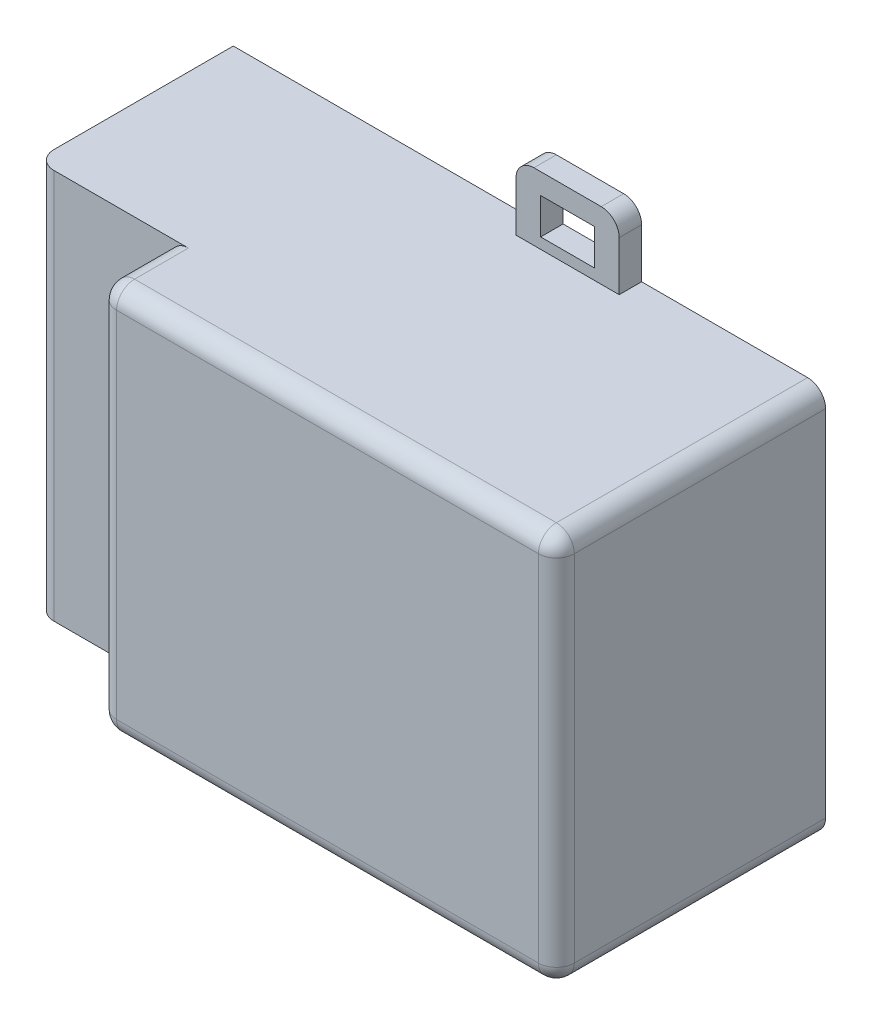
from build123d import *

# Parameters (mm, degrees)
ESQUISSE1_W        = 66
ESQUISSE1_H        = 43.5
BOSS_EXTRU_1_DEPTH = 22
ESQUISSE2_W        = 51
ESQUISSE2_H        = 43.5
BOSS_EXTRU_2_DEPTH = 8
ESQUISSE3_W        = 11.5
ESQUISSE3_H        = 7.5
ESQUISSE3_W_2      = 6
ESQUISSE3_H_2      = 4
BOSS_EXTRU_3_DEPTH = 2.5
CONG_1_R           = 2


with BuildPart() as part:
    # Esquisse1 → Boss.-Extru.1 (new body)
    with BuildSketch(Plane.XY):
        with Locations((2.845632419, 0)):
            Rectangle(ESQUISSE1_W, ESQUISSE1_H)
    extrude(amount=BOSS_EXTRU_1_DEPTH)

    # Esquisse2 → Boss.-Extru.2 (add)
    with BuildSketch(Plane.XY.offset(22)):
        with Locations((10.345632419, 0)):
            Rectangle(ESQUISSE2_W, ESQUISSE2_H)
    extrude(amount=BOSS_EXTRU_2_DEPTH)

    # Esquisse3 → Boss.-Extru.3 (add)
    # profile 1 of 2: a face of its own
    with BuildSketch(Plane(origin=(0, 0, 0), x_dir=(-1, 0, 0), z_dir=(0, 0, -1))):
        with Locations((-9.595632419, 25.5)):
            Rectangle(ESQUISSE3_W, ESQUISSE3_H)
        with Locations((-9.595632419, 24.95)):
            Rectangle(ESQUISSE3_W_2, ESQUISSE3_H_2, mode=Mode.SUBTRACT)
    # profile 2 of 2: a face of its own
    with BuildSketch(Plane(origin=(0, 0, 0), x_dir=(-1, 0, 0), z_dir=(0, 0, -1))):
        with Locations((-9.595632419, -25.5)):
            Rectangle(ESQUISSE3_W, ESQUISSE3_H)
        with Locations((-9.595632419, -24.95)):
            Rectangle(ESQUISSE3_W_2, ESQUISSE3_H_2, mode=Mode.SUBTRACT)
    extrude(amount=-BOSS_EXTRU_3_DEPTH)

    # Congé1
    cong_1_edges = [part.edges().sort_by_distance(p)[0] for p in [
        (-15.154367581, 21.75, 26),
        (-15.154367581, -21.75, 26),
        (10.345632419, -21.75, 30),
        (35.845632419, 0, 30),
        (10.345632419, 21.75, 30),
        (-15.154367581, 0, 30),
        (15.345632419, 29.25, 1.25),
        (3.845632419, 29.25, 1.25),
        (-30.154367581, 0, 22),
        (15.345632419, -29.25, 1.25),
        (3.845632419, -29.25, 1.25),
        (35.845632419, 21.75, 15),
        (35.845632419, -21.75, 15),
    ]]
    fillet(cong_1_edges, radius=CONG_1_R)


solid = part.part
